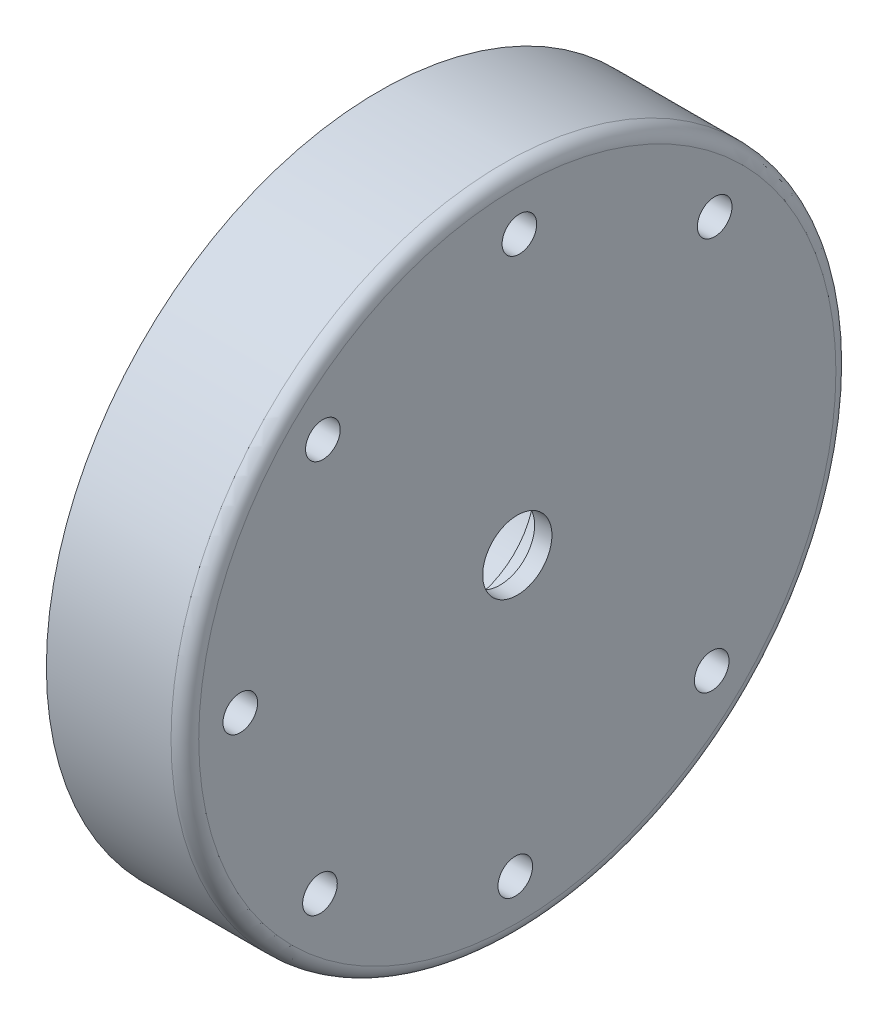
from build123d import *

# Parameters (mm, degrees)
SKETCH1_R           = 60.96
BOSS_EXTRUDE1_DEPTH = 25.4
FILLET1_R           = 2.54
SKETCH2_R           = 4.508
CUT_EXTRUDE1_DEPTH  = 6.35
SKETCH4_R           = 6.35
CUT_EXTRUDE3_DEPTH  = 90.874374546
SKETCH5_R           = 3.175
CUT_EXTRUDE4_DEPTH  = 90.874374546
CIRPATTERN2_COUNT   = 8
SKETCH6_R           = 14.605
CUT_EXTRUDE5_DEPTH  = 22.225
BOSS_EXTRUDE2_START = 6.35
SKETCH7_R           = 14.605
SKETCH7_R_2         = 12.7
BOSS_EXTRUDE2_DEPTH = 6.35
BOSS_EXTRUDE3_START = 8.89
SKETCH8_R           = 17.499965
SKETCH8_R_2         = 14.605
BOSS_EXTRUDE3_DEPTH = 8.89


with BuildPart() as part:
    # Sketch1 → Boss-Extrude1 (new body)
    with BuildSketch(Plane(origin=(0, 0, 0), x_dir=(0, 0, -1), z_dir=(1, 0, 0))):
        Circle(SKETCH1_R)
    extrude(amount=BOSS_EXTRUDE1_DEPTH)

    # Fillet1
    fillet1_edges = [part.edges().sort_by_distance(p)[0] for p in [
        (25.4, 0, 60.96),
    ]]
    fillet(fillet1_edges, radius=FILLET1_R)

    # Sketch2 → Cut-Extrude1 (cut)
    with BuildSketch(Plane(origin=(25.4, 0, 0), x_dir=(0, 0, -1), z_dir=(1, 0, 0))):
        Circle(SKETCH2_R)
    extrude(amount=-CUT_EXTRUDE1_DEPTH, mode=Mode.SUBTRACT)

    # Sketch4 → Cut-Extrude3 (cut, through all)
    with BuildSketch(Plane(origin=(25.4, 0, 0), x_dir=(0, 0, -1), z_dir=(1, 0, 0))):
        Circle(SKETCH4_R)
    extrude(amount=-CUT_EXTRUDE3_DEPTH, mode=Mode.SUBTRACT)

    # Sketch5 → Cut-Extrude4 (cut, through all)
    with BuildSketch(Plane.ZY):
        with Locations((-36.188764222, 35.651274088)):
            Circle(SKETCH5_R)
    cut_extrude4 = extrude(amount=-CUT_EXTRUDE4_DEPTH, mode=Mode.SUBTRACT)

    # CirPattern2: Cut-Extrude4 ×8 about axis, 1 skipped
    cirpattern2_axis = Axis((0, 0, 0), (1, 0, 0))
    add([cut_extrude4.rotate(cirpattern2_axis, i * 360 / CIRPATTERN2_COUNT) for i in range(1, CIRPATTERN2_COUNT) if i not in (7,)], mode=Mode.SUBTRACT)

    # Sketch6 → Cut-Extrude5 (cut)
    with BuildSketch(Plane.ZY):
        Circle(SKETCH6_R)
    extrude(amount=-CUT_EXTRUDE5_DEPTH, mode=Mode.SUBTRACT)

    # Sketch7 → Boss-Extrude2 (add)
    with BuildSketch(Plane.ZY.offset(-22.225).offset(BOSS_EXTRUDE2_START)):
        Circle(SKETCH7_R)
        Circle(SKETCH7_R_2, mode=Mode.SUBTRACT)
    extrude(amount=-BOSS_EXTRUDE2_DEPTH)

    # Sketch8 → Boss-Extrude3 (add)
    with BuildSketch(Plane.ZY.offset(BOSS_EXTRUDE3_START)):
        with Locations(Location((0, 0, 0), (0, 0, 180))):
            Circle(SKETCH8_R)
        Circle(SKETCH8_R_2, mode=Mode.SUBTRACT)
    extrude(amount=-BOSS_EXTRUDE3_DEPTH)


solid = part.part
